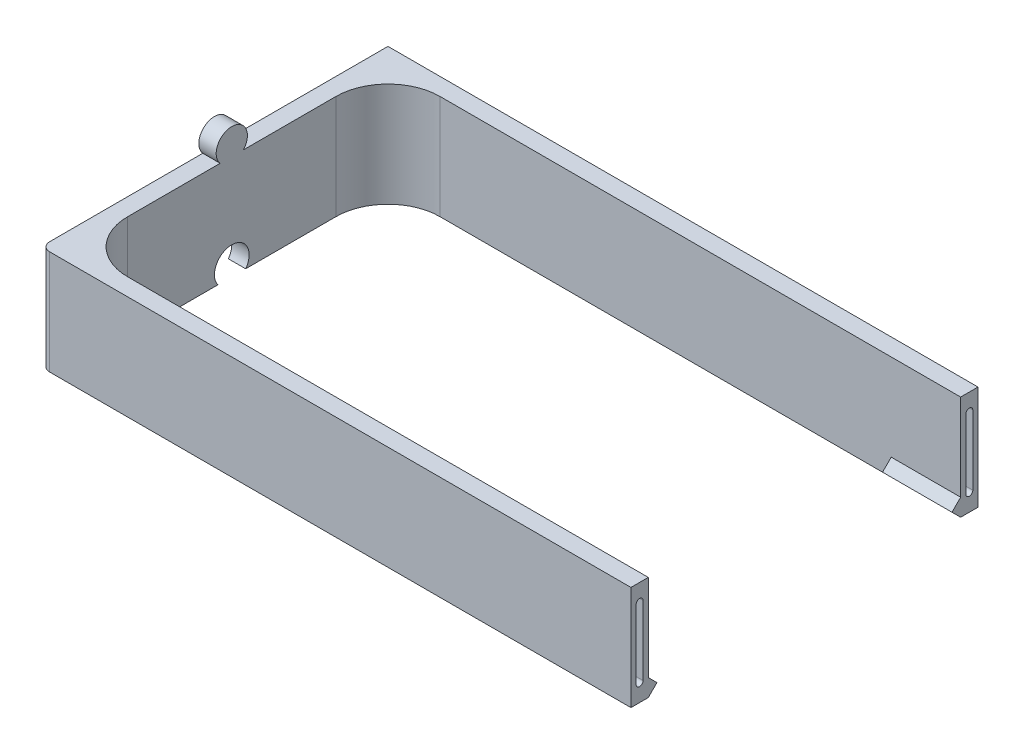
from build123d import *

# Parameters (mm, degrees)
BOSS_EXTRUDE1_DEPTH      = 30
SKETCH2_R                = 5
CUT_EXTRUDE1_DEPTH       = 30
BOSS_EXTRUDE2_DEPTH      = 10
BOSS_EXTRUDE2_DEPTH_BACK = 10
SKETCH4_W                = 159.060966422
SKETCH4_H                = 100
CUT_EXTRUDE2_DEPTH       = 55
CUT_EXTRUDE3_DEPTH       = 10
CUT_EXTRUDE3_DEPTH_BACK  = 5
SKETCH6_R                = 4.5
BOSS_EXTRUDE3_DEPTH      = 5


with BuildPart() as part:
    # Sketch1 → Boss-Extrude1 (new body)
    with BuildSketch(Plane(origin=(0, 0, 0), x_dir=(1, 0, 0), z_dir=(0, 1, 0))):
        with BuildLine():
            Line((2.5, 100), (0, 100))
            Line((0, 100), (0, 97.5))
            Line((0, 97.5), (0, 2.5))
            ThreePointArc((0, 2.5), (0.732233047, 0.732233047), (2.5, 0))
            Line((2.5, 0), (305, 0))
            ThreePointArc((305, 0), (315.606601718, 4.393398282), (320, 15))
            Line((320, 15), (320, 85))
            ThreePointArc((320, 85), (315.606601718, 95.606601718), (305, 100))
            Line((305, 100), (2.5, 100))
        make_face()
        with BuildLine():
            Line((20, 95), (300, 95))
            ThreePointArc((300, 95), (310.606601718, 90.606601718), (315, 80))
            Line((315, 80), (315, 20))
            ThreePointArc((315, 20), (310.606601718, 9.393398282), (300, 5))
            Line((300, 5), (20, 5))
            ThreePointArc((20, 5), (9.393398282, 9.393398282), (5, 20))
            Line((5, 20), (5, 80))
            ThreePointArc((5, 80), (9.393398282, 90.606601718), (20, 95))
        make_face(mode=Mode.SUBTRACT)
    extrude(amount=BOSS_EXTRUDE1_DEPTH)

    # Sketch2 → Cut-Extrude1 (cut)
    with BuildSketch(Plane(origin=(0, 0, 0), x_dir=(0, 0, -1), z_dir=(1, 0, 0))):
        with Locations((50, 3)):
            Circle(SKETCH2_R)
    extrude(amount=CUT_EXTRUDE1_DEPTH, mode=Mode.SUBTRACT)

    # Sketch3 → Boss-Extrude2 (add, two sides: drawn at the far end of the back side and taken through both)
    with BuildSketch(Plane(origin=(160, 0, 0), x_dir=(0, 0, -1), z_dir=(1, 0, 0)).offset(-BOSS_EXTRUDE2_DEPTH_BACK)):
        Polygon((5, 0), (5, 5), (7.5, 2.5), align=None)
        Polygon((95, 0), (95, 5), (92.5, 2.5), align=None)
    extrude(amount=BOSS_EXTRUDE2_DEPTH + BOSS_EXTRUDE2_DEPTH_BACK)

    # Sketch4 → Cut-Extrude2 (cut)
    with BuildSketch(Plane(origin=(0, 0, 0), x_dir=(1, 0, 0), z_dir=(0, 1, 0))):
        with Locations((249.530483211, 50)):
            Rectangle(SKETCH4_W, SKETCH4_H)
    extrude(amount=CUT_EXTRUDE2_DEPTH, mode=Mode.SUBTRACT)

    # Sketch5 → Cut-Extrude3 (cut, two sides: drawn at the far end of the back side and taken through both)
    with BuildSketch(Plane(origin=(160, 0, 0), x_dir=(0, 0, -1), z_dir=(1, 0, 0)).offset(-CUT_EXTRUDE3_DEPTH_BACK)):
        with BuildLine():
            ThreePointArc((3.5, 25), (3.207106781, 25.707106781), (2.5, 26))
            Line((2.5, 26), (2.5, 4))
            ThreePointArc((2.5, 4), (3.207106781, 4.292893219), (3.5, 5))
            Line((3.5, 5), (3.5, 25))
        make_face()
        with BuildLine():
            Line((2.5, 4), (2.5, 26))
            ThreePointArc((2.5, 26), (1.792893219, 25.707106781), (1.5, 25))
            Line((1.5, 25), (1.5, 5))
            ThreePointArc((1.5, 5), (1.792893219, 4.292893219), (2.5, 4))
        make_face()
        with BuildLine():
            ThreePointArc((98.5, 25), (98.207106781, 25.707106781), (97.5, 26))
            Line((97.5, 26), (97.5, 4))
            ThreePointArc((97.5, 4), (98.207106781, 4.292893219), (98.5, 5))
            Line((98.5, 5), (98.5, 25))
        make_face()
        with BuildLine():
            Line((97.5, 4), (97.5, 26))
            ThreePointArc((97.5, 26), (96.792893219, 25.707106781), (96.5, 25))
            Line((96.5, 25), (96.5, 5))
            ThreePointArc((96.5, 5), (96.792893219, 4.292893219), (97.5, 4))
        make_face()
    extrude(amount=CUT_EXTRUDE3_DEPTH + CUT_EXTRUDE3_DEPTH_BACK, mode=Mode.SUBTRACT)

    # Sketch6 → Boss-Extrude3 (add)
    with BuildSketch(Plane(origin=(0, 0, 0), x_dir=(0, 0, -1), z_dir=(1, 0, 0))):
        with Locations((50, 33)):
            Circle(SKETCH6_R)
    extrude(amount=BOSS_EXTRUDE3_DEPTH)


solid = part.part
